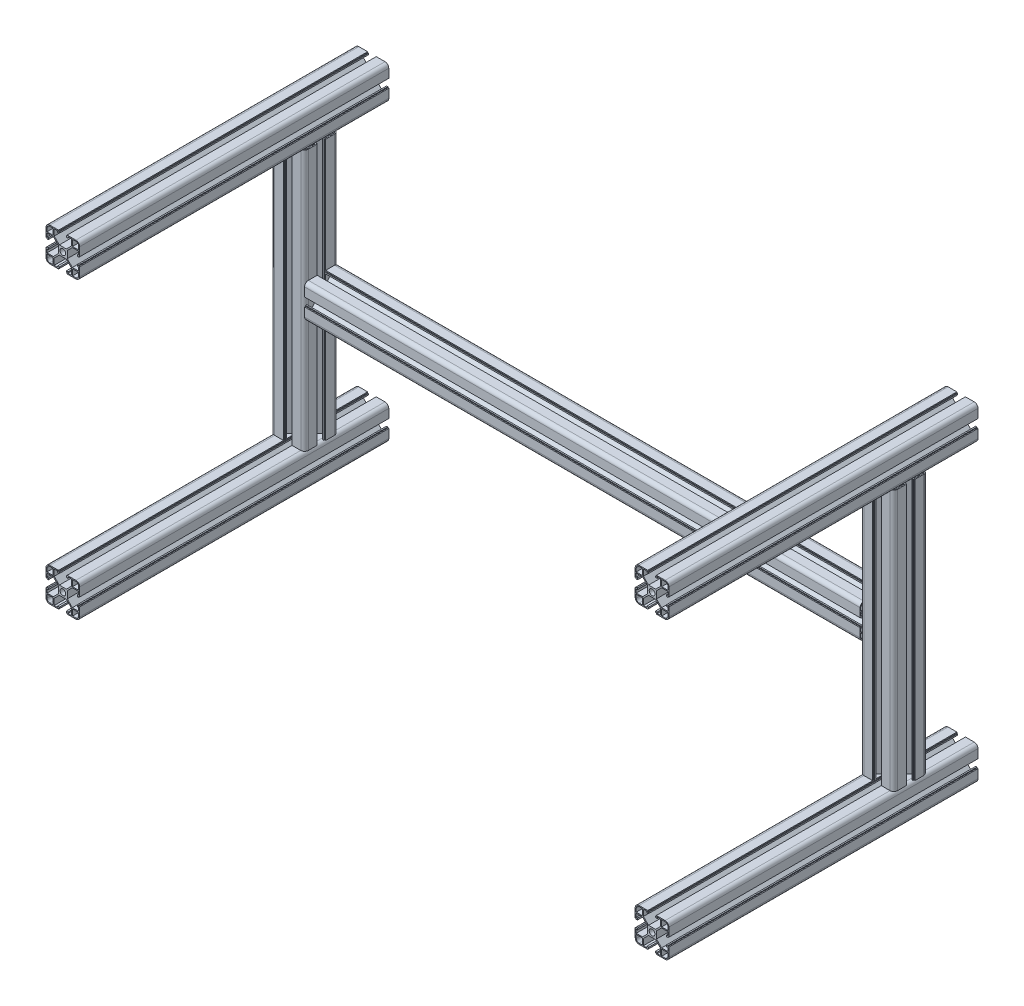
from build123d import *

# Parameters (mm, degrees)
SKETCH_1_R                         = 3.4
MEMBER_4040_1_5_4040_1_5_1_DEPTH   = 367.21
SKETCH_1_ON_SEGMENT_2_R            = 3.4
MEMBER_4040_1_5_4040_1_5_1_2_DEPTH = 367.21
SKETCH_1_ON_SEGMENT_3_R            = 3.4
MEMBER_4040_1_5_4040_1_5_1_3_DEPTH = 367.21
SKETCH_1_ON_SEGMENT_4_R            = 3.4
MEMBER_4040_1_5_4040_1_5_1_4_DEPTH = 367.21
SKETCH_1_ON_SEGMENT_5_R            = 3.4
MEMBER_4040_1_5_4040_1_5_1_5_DEPTH = 352
SKETCH_1_ON_SEGMENT_6_R            = 3.4
MEMBER_4040_1_5_4040_1_5_1_6_DEPTH = 352
SKETCH_1_ON_SEGMENT_7_R            = 3.4
MEMBER_4040_1_5_4040_1_5_1_7_DEPTH = 702


with BuildPart() as part:
    # 草图1 → Member 4040-_1.5 _4040_1.5_1 (new body)
    with BuildSketch(Plane(origin=(-350, -175, 0), x_dir=(1, 0, 0), z_dir=(0, 0, 1))):
        with BuildLine():
            Line((-5.25, -4.189339828), (-5.25, 4.189339828))
            Line((-5.25, 4.189339828), (-11.310660172, 10.25))
            Line((-11.310660172, 10.25), (-18.8, 10.25))
            Line((-18.8, 10.25), (-18.8, 6.1))
            Line((-18.8, 6.1), (-17.3, 6.1))
            Line((-17.3, 6.1), (-17.3, 4.1))
            Line((-17.3, 4.1), (-18.8, 4.1))
            Line((-18.8, 4.1), (-18.8, 5.1))
            Line((-18.8, 5.1), (-20, 5.1))
            Line((-20, 5.1), (-20, 15.5))
            ThreePointArc((-20, 15.5), (-18.681980515, 18.681980515), (-15.5, 20))
            Line((-15.5, 20), (-5.1, 20))
            Line((-5.1, 20), (-5.1, 18.8))
            Line((-5.1, 18.8), (-4.1, 18.8))
            Line((-4.1, 18.8), (-4.1, 17.3))
            Line((-4.1, 17.3), (-6.1, 17.3))
            Line((-6.1, 17.3), (-6.1, 18.8))
            Line((-6.1, 18.8), (-10.25, 18.8))
            Line((-10.25, 18.8), (-10.25, 11.310660172))
            Line((-10.25, 11.310660172), (-4.189339828, 5.25))
            Line((-4.189339828, 5.25), (4.189339828, 5.25))
            Line((4.189339828, 5.25), (10.25, 11.310660172))
            Line((10.25, 11.310660172), (10.25, 18.8))
            Line((10.25, 18.8), (6.1, 18.8))
            Line((6.1, 18.8), (6.1, 17.3))
            Line((6.1, 17.3), (4.1, 17.3))
            Line((4.1, 17.3), (4.1, 18.8))
            Line((4.1, 18.8), (5.1, 18.8))
            Line((5.1, 18.8), (5.1, 20))
            Line((5.1, 20), (15.5, 20))
            ThreePointArc((15.5, 20), (18.681980515, 18.681980515), (20, 15.5))
            Line((20, 15.5), (20, 5.1))
            Line((20, 5.1), (18.8, 5.1))
            Line((18.8, 5.1), (18.8, 4.1))
            Line((18.8, 4.1), (17.3, 4.1))
            Line((17.3, 4.1), (17.3, 6.1))
            Line((17.3, 6.1), (18.8, 6.1))
            Line((18.8, 6.1), (18.8, 10.25))
            Line((18.8, 10.25), (11.310660172, 10.25))
            Line((11.310660172, 10.25), (5.25, 4.189339828))
            Line((5.25, 4.189339828), (5.25, -4.189339828))
            Line((5.25, -4.189339828), (11.310660172, -10.25))
            Line((11.310660172, -10.25), (18.8, -10.25))
            Line((18.8, -10.25), (18.8, -6.1))
            Line((18.8, -6.1), (17.3, -6.1))
            Line((17.3, -6.1), (17.3, -4.1))
            Line((17.3, -4.1), (18.8, -4.1))
            Line((18.8, -4.1), (18.8, -5.1))
            Line((18.8, -5.1), (20, -5.1))
            Line((20, -5.1), (20, -15.5))
            ThreePointArc((20, -15.5), (18.681980515, -18.681980515), (15.5, -20))
            Line((15.5, -20), (5.1, -20))
            Line((5.1, -20), (5.1, -18.8))
            Line((5.1, -18.8), (4.1, -18.8))
            Line((4.1, -18.8), (4.1, -17.3))
            Line((4.1, -17.3), (6.1, -17.3))
            Line((6.1, -17.3), (6.1, -18.8))
            Line((6.1, -18.8), (10.25, -18.8))
            Line((10.25, -18.8), (10.25, -11.310660172))
            Line((10.25, -11.310660172), (4.189339828, -5.25))
            Line((4.189339828, -5.25), (-4.189339828, -5.25))
            Line((-4.189339828, -5.25), (-10.25, -11.310660172))
            Line((-10.25, -11.310660172), (-10.25, -18.8))
            Line((-10.25, -18.8), (-6.1, -18.8))
            Line((-6.1, -18.8), (-6.1, -17.3))
            Line((-6.1, -17.3), (-4.1, -17.3))
            Line((-4.1, -17.3), (-4.1, -18.8))
            Line((-4.1, -18.8), (-5.1, -18.8))
            Line((-5.1, -18.8), (-5.1, -20))
            Line((-5.1, -20), (-15.5, -20))
            ThreePointArc((-15.5, -20), (-18.681980515, -18.681980515), (-20, -15.5))
            Line((-20, -15.5), (-20, -5.1))
            Line((-20, -5.1), (-18.8, -5.1))
            Line((-18.8, -5.1), (-18.8, -4.1))
            Line((-18.8, -4.1), (-17.3, -4.1))
            Line((-17.3, -4.1), (-17.3, -6.1))
            Line((-17.3, -6.1), (-18.8, -6.1))
            Line((-18.8, -6.1), (-18.8, -10.25))
            Line((-18.8, -10.25), (-11.310660172, -10.25))
            Line((-11.310660172, -10.25), (-5.25, -4.189339828))
        make_face()
        Circle(SKETCH_1_R, mode=Mode.SUBTRACT)
        with BuildLine():
            Line((-11.45, 11.45), (-18.8, 11.45))
            Line((-18.8, 11.45), (-18.8, 15.5))
            ThreePointArc((-18.8, 15.5), (-17.833452378, 17.833452378), (-15.5, 18.8))
            Line((-15.5, 18.8), (-11.45, 18.8))
            Line((-11.45, 18.8), (-11.45, 11.45))
        make_face(mode=Mode.SUBTRACT)
        with BuildLine():
            Line((11.45, 11.45), (18.8, 11.45))
            Line((18.8, 11.45), (18.8, 15.5))
            ThreePointArc((18.8, 15.5), (17.833452378, 17.833452378), (15.5, 18.8))
            Line((15.5, 18.8), (11.45, 18.8))
            Line((11.45, 18.8), (11.45, 11.45))
        make_face(mode=Mode.SUBTRACT)
        with BuildLine():
            Line((11.45, -18.8), (15.5, -18.8))
            ThreePointArc((15.5, -18.8), (17.833452378, -17.833452378), (18.8, -15.5))
            Line((18.8, -15.5), (18.8, -11.45))
            Line((18.8, -11.45), (11.45, -11.45))
            Line((11.45, -11.45), (11.45, -18.8))
        make_face(mode=Mode.SUBTRACT)
        with BuildLine():
            Line((-11.45, -11.45), (-11.45, -18.8))
            Line((-11.45, -18.8), (-15.5, -18.8))
            ThreePointArc((-15.5, -18.8), (-17.833452378, -17.833452378), (-18.8, -15.5))
            Line((-18.8, -15.5), (-18.8, -11.45))
            Line((-18.8, -11.45), (-11.45, -11.45))
        make_face(mode=Mode.SUBTRACT)
    extrude(amount=MEMBER_4040_1_5_4040_1_5_1_DEPTH)


with BuildPart() as body_2:
    # 草图1 on segment 2 (carried to segment 2) → Member 4040-_1.5 _4040_1.5_1 2 (new body)
    with BuildSketch(Plane(origin=(-350, 175, 0), x_dir=(1, 0, 0), z_dir=(0, 0, 1))):
        with BuildLine():
            Line((-5.25, -4.189339828), (-5.25, 4.189339828))
            Line((-5.25, 4.189339828), (-11.310660172, 10.25))
            Line((-11.310660172, 10.25), (-18.8, 10.25))
            Line((-18.8, 10.25), (-18.8, 6.1))
            Line((-18.8, 6.1), (-17.3, 6.1))
            Line((-17.3, 6.1), (-17.3, 4.1))
            Line((-17.3, 4.1), (-18.8, 4.1))
            Line((-18.8, 4.1), (-18.8, 5.1))
            Line((-18.8, 5.1), (-20, 5.1))
            Line((-20, 5.1), (-20, 15.5))
            ThreePointArc((-20, 15.5), (-18.681980515, 18.681980515), (-15.5, 20))
            Line((-15.5, 20), (-5.1, 20))
            Line((-5.1, 20), (-5.1, 18.8))
            Line((-5.1, 18.8), (-4.1, 18.8))
            Line((-4.1, 18.8), (-4.1, 17.3))
            Line((-4.1, 17.3), (-6.1, 17.3))
            Line((-6.1, 17.3), (-6.1, 18.8))
            Line((-6.1, 18.8), (-10.25, 18.8))
            Line((-10.25, 18.8), (-10.25, 11.310660172))
            Line((-10.25, 11.310660172), (-4.189339828, 5.25))
            Line((-4.189339828, 5.25), (4.189339828, 5.25))
            Line((4.189339828, 5.25), (10.25, 11.310660172))
            Line((10.25, 11.310660172), (10.25, 18.8))
            Line((10.25, 18.8), (6.1, 18.8))
            Line((6.1, 18.8), (6.1, 17.3))
            Line((6.1, 17.3), (4.1, 17.3))
            Line((4.1, 17.3), (4.1, 18.8))
            Line((4.1, 18.8), (5.1, 18.8))
            Line((5.1, 18.8), (5.1, 20))
            Line((5.1, 20), (15.5, 20))
            ThreePointArc((15.5, 20), (18.681980515, 18.681980515), (20, 15.5))
            Line((20, 15.5), (20, 5.1))
            Line((20, 5.1), (18.8, 5.1))
            Line((18.8, 5.1), (18.8, 4.1))
            Line((18.8, 4.1), (17.3, 4.1))
            Line((17.3, 4.1), (17.3, 6.1))
            Line((17.3, 6.1), (18.8, 6.1))
            Line((18.8, 6.1), (18.8, 10.25))
            Line((18.8, 10.25), (11.310660172, 10.25))
            Line((11.310660172, 10.25), (5.25, 4.189339828))
            Line((5.25, 4.189339828), (5.25, -4.189339828))
            Line((5.25, -4.189339828), (11.310660172, -10.25))
            Line((11.310660172, -10.25), (18.8, -10.25))
            Line((18.8, -10.25), (18.8, -6.1))
            Line((18.8, -6.1), (17.3, -6.1))
            Line((17.3, -6.1), (17.3, -4.1))
            Line((17.3, -4.1), (18.8, -4.1))
            Line((18.8, -4.1), (18.8, -5.1))
            Line((18.8, -5.1), (20, -5.1))
            Line((20, -5.1), (20, -15.5))
            ThreePointArc((20, -15.5), (18.681980515, -18.681980515), (15.5, -20))
            Line((15.5, -20), (5.1, -20))
            Line((5.1, -20), (5.1, -18.8))
            Line((5.1, -18.8), (4.1, -18.8))
            Line((4.1, -18.8), (4.1, -17.3))
            Line((4.1, -17.3), (6.1, -17.3))
            Line((6.1, -17.3), (6.1, -18.8))
            Line((6.1, -18.8), (10.25, -18.8))
            Line((10.25, -18.8), (10.25, -11.310660172))
            Line((10.25, -11.310660172), (4.189339828, -5.25))
            Line((4.189339828, -5.25), (-4.189339828, -5.25))
            Line((-4.189339828, -5.25), (-10.25, -11.310660172))
            Line((-10.25, -11.310660172), (-10.25, -18.8))
            Line((-10.25, -18.8), (-6.1, -18.8))
            Line((-6.1, -18.8), (-6.1, -17.3))
            Line((-6.1, -17.3), (-4.1, -17.3))
            Line((-4.1, -17.3), (-4.1, -18.8))
            Line((-4.1, -18.8), (-5.1, -18.8))
            Line((-5.1, -18.8), (-5.1, -20))
            Line((-5.1, -20), (-15.5, -20))
            ThreePointArc((-15.5, -20), (-18.681980515, -18.681980515), (-20, -15.5))
            Line((-20, -15.5), (-20, -5.1))
            Line((-20, -5.1), (-18.8, -5.1))
            Line((-18.8, -5.1), (-18.8, -4.1))
            Line((-18.8, -4.1), (-17.3, -4.1))
            Line((-17.3, -4.1), (-17.3, -6.1))
            Line((-17.3, -6.1), (-18.8, -6.1))
            Line((-18.8, -6.1), (-18.8, -10.25))
            Line((-18.8, -10.25), (-11.310660172, -10.25))
            Line((-11.310660172, -10.25), (-5.25, -4.189339828))
        make_face()
        Circle(SKETCH_1_ON_SEGMENT_2_R, mode=Mode.SUBTRACT)
        with BuildLine():
            Line((-11.45, 11.45), (-18.8, 11.45))
            Line((-18.8, 11.45), (-18.8, 15.5))
            ThreePointArc((-18.8, 15.5), (-17.833452378, 17.833452378), (-15.5, 18.8))
            Line((-15.5, 18.8), (-11.45, 18.8))
            Line((-11.45, 18.8), (-11.45, 11.45))
        make_face(mode=Mode.SUBTRACT)
        with BuildLine():
            Line((11.45, 11.45), (18.8, 11.45))
            Line((18.8, 11.45), (18.8, 15.5))
            ThreePointArc((18.8, 15.5), (17.833452378, 17.833452378), (15.5, 18.8))
            Line((15.5, 18.8), (11.45, 18.8))
            Line((11.45, 18.8), (11.45, 11.45))
        make_face(mode=Mode.SUBTRACT)
        with BuildLine():
            Line((11.45, -18.8), (15.5, -18.8))
            ThreePointArc((15.5, -18.8), (17.833452378, -17.833452378), (18.8, -15.5))
            Line((18.8, -15.5), (18.8, -11.45))
            Line((18.8, -11.45), (11.45, -11.45))
            Line((11.45, -11.45), (11.45, -18.8))
        make_face(mode=Mode.SUBTRACT)
        with BuildLine():
            Line((-11.45, -11.45), (-11.45, -18.8))
            Line((-11.45, -18.8), (-15.5, -18.8))
            ThreePointArc((-15.5, -18.8), (-17.833452378, -17.833452378), (-18.8, -15.5))
            Line((-18.8, -15.5), (-18.8, -11.45))
            Line((-18.8, -11.45), (-11.45, -11.45))
        make_face(mode=Mode.SUBTRACT)
    extrude(amount=MEMBER_4040_1_5_4040_1_5_1_2_DEPTH)


with BuildPart() as body_3:
    # 草图1 on segment 3 (carried to segment 3) → Member 4040-_1.5 _4040_1.5_1 3 (new body)
    with BuildSketch(Plane(origin=(350, 175, 0), x_dir=(1, 0, 0), z_dir=(0, 0, 1))):
        with BuildLine():
            Line((-5.25, -4.189339828), (-5.25, 4.189339828))
            Line((-5.25, 4.189339828), (-11.310660172, 10.25))
            Line((-11.310660172, 10.25), (-18.8, 10.25))
            Line((-18.8, 10.25), (-18.8, 6.1))
            Line((-18.8, 6.1), (-17.3, 6.1))
            Line((-17.3, 6.1), (-17.3, 4.1))
            Line((-17.3, 4.1), (-18.8, 4.1))
            Line((-18.8, 4.1), (-18.8, 5.1))
            Line((-18.8, 5.1), (-20, 5.1))
            Line((-20, 5.1), (-20, 15.5))
            ThreePointArc((-20, 15.5), (-18.681980515, 18.681980515), (-15.5, 20))
            Line((-15.5, 20), (-5.1, 20))
            Line((-5.1, 20), (-5.1, 18.8))
            Line((-5.1, 18.8), (-4.1, 18.8))
            Line((-4.1, 18.8), (-4.1, 17.3))
            Line((-4.1, 17.3), (-6.1, 17.3))
            Line((-6.1, 17.3), (-6.1, 18.8))
            Line((-6.1, 18.8), (-10.25, 18.8))
            Line((-10.25, 18.8), (-10.25, 11.310660172))
            Line((-10.25, 11.310660172), (-4.189339828, 5.25))
            Line((-4.189339828, 5.25), (4.189339828, 5.25))
            Line((4.189339828, 5.25), (10.25, 11.310660172))
            Line((10.25, 11.310660172), (10.25, 18.8))
            Line((10.25, 18.8), (6.1, 18.8))
            Line((6.1, 18.8), (6.1, 17.3))
            Line((6.1, 17.3), (4.1, 17.3))
            Line((4.1, 17.3), (4.1, 18.8))
            Line((4.1, 18.8), (5.1, 18.8))
            Line((5.1, 18.8), (5.1, 20))
            Line((5.1, 20), (15.5, 20))
            ThreePointArc((15.5, 20), (18.681980515, 18.681980515), (20, 15.5))
            Line((20, 15.5), (20, 5.1))
            Line((20, 5.1), (18.8, 5.1))
            Line((18.8, 5.1), (18.8, 4.1))
            Line((18.8, 4.1), (17.3, 4.1))
            Line((17.3, 4.1), (17.3, 6.1))
            Line((17.3, 6.1), (18.8, 6.1))
            Line((18.8, 6.1), (18.8, 10.25))
            Line((18.8, 10.25), (11.310660172, 10.25))
            Line((11.310660172, 10.25), (5.25, 4.189339828))
            Line((5.25, 4.189339828), (5.25, -4.189339828))
            Line((5.25, -4.189339828), (11.310660172, -10.25))
            Line((11.310660172, -10.25), (18.8, -10.25))
            Line((18.8, -10.25), (18.8, -6.1))
            Line((18.8, -6.1), (17.3, -6.1))
            Line((17.3, -6.1), (17.3, -4.1))
            Line((17.3, -4.1), (18.8, -4.1))
            Line((18.8, -4.1), (18.8, -5.1))
            Line((18.8, -5.1), (20, -5.1))
            Line((20, -5.1), (20, -15.5))
            ThreePointArc((20, -15.5), (18.681980515, -18.681980515), (15.5, -20))
            Line((15.5, -20), (5.1, -20))
            Line((5.1, -20), (5.1, -18.8))
            Line((5.1, -18.8), (4.1, -18.8))
            Line((4.1, -18.8), (4.1, -17.3))
            Line((4.1, -17.3), (6.1, -17.3))
            Line((6.1, -17.3), (6.1, -18.8))
            Line((6.1, -18.8), (10.25, -18.8))
            Line((10.25, -18.8), (10.25, -11.310660172))
            Line((10.25, -11.310660172), (4.189339828, -5.25))
            Line((4.189339828, -5.25), (-4.189339828, -5.25))
            Line((-4.189339828, -5.25), (-10.25, -11.310660172))
            Line((-10.25, -11.310660172), (-10.25, -18.8))
            Line((-10.25, -18.8), (-6.1, -18.8))
            Line((-6.1, -18.8), (-6.1, -17.3))
            Line((-6.1, -17.3), (-4.1, -17.3))
            Line((-4.1, -17.3), (-4.1, -18.8))
            Line((-4.1, -18.8), (-5.1, -18.8))
            Line((-5.1, -18.8), (-5.1, -20))
            Line((-5.1, -20), (-15.5, -20))
            ThreePointArc((-15.5, -20), (-18.681980515, -18.681980515), (-20, -15.5))
            Line((-20, -15.5), (-20, -5.1))
            Line((-20, -5.1), (-18.8, -5.1))
            Line((-18.8, -5.1), (-18.8, -4.1))
            Line((-18.8, -4.1), (-17.3, -4.1))
            Line((-17.3, -4.1), (-17.3, -6.1))
            Line((-17.3, -6.1), (-18.8, -6.1))
            Line((-18.8, -6.1), (-18.8, -10.25))
            Line((-18.8, -10.25), (-11.310660172, -10.25))
            Line((-11.310660172, -10.25), (-5.25, -4.189339828))
        make_face()
        Circle(SKETCH_1_ON_SEGMENT_3_R, mode=Mode.SUBTRACT)
        with BuildLine():
            Line((-11.45, 11.45), (-18.8, 11.45))
            Line((-18.8, 11.45), (-18.8, 15.5))
            ThreePointArc((-18.8, 15.5), (-17.833452378, 17.833452378), (-15.5, 18.8))
            Line((-15.5, 18.8), (-11.45, 18.8))
            Line((-11.45, 18.8), (-11.45, 11.45))
        make_face(mode=Mode.SUBTRACT)
        with BuildLine():
            Line((11.45, 11.45), (18.8, 11.45))
            Line((18.8, 11.45), (18.8, 15.5))
            ThreePointArc((18.8, 15.5), (17.833452378, 17.833452378), (15.5, 18.8))
            Line((15.5, 18.8), (11.45, 18.8))
            Line((11.45, 18.8), (11.45, 11.45))
        make_face(mode=Mode.SUBTRACT)
        with BuildLine():
            Line((11.45, -18.8), (15.5, -18.8))
            ThreePointArc((15.5, -18.8), (17.833452378, -17.833452378), (18.8, -15.5))
            Line((18.8, -15.5), (18.8, -11.45))
            Line((18.8, -11.45), (11.45, -11.45))
            Line((11.45, -11.45), (11.45, -18.8))
        make_face(mode=Mode.SUBTRACT)
        with BuildLine():
            Line((-11.45, -11.45), (-11.45, -18.8))
            Line((-11.45, -18.8), (-15.5, -18.8))
            ThreePointArc((-15.5, -18.8), (-17.833452378, -17.833452378), (-18.8, -15.5))
            Line((-18.8, -15.5), (-18.8, -11.45))
            Line((-18.8, -11.45), (-11.45, -11.45))
        make_face(mode=Mode.SUBTRACT)
    extrude(amount=MEMBER_4040_1_5_4040_1_5_1_3_DEPTH)


with BuildPart() as body_4:
    # 草图1 on segment 4 (carried to segment 4) → Member 4040-_1.5 _4040_1.5_1 4 (new body)
    with BuildSketch(Plane(origin=(350, -175, 0), x_dir=(1, 0, 0), z_dir=(0, 0, 1))):
        with BuildLine():
            Line((-5.25, -4.189339828), (-5.25, 4.189339828))
            Line((-5.25, 4.189339828), (-11.310660172, 10.25))
            Line((-11.310660172, 10.25), (-18.8, 10.25))
            Line((-18.8, 10.25), (-18.8, 6.1))
            Line((-18.8, 6.1), (-17.3, 6.1))
            Line((-17.3, 6.1), (-17.3, 4.1))
            Line((-17.3, 4.1), (-18.8, 4.1))
            Line((-18.8, 4.1), (-18.8, 5.1))
            Line((-18.8, 5.1), (-20, 5.1))
            Line((-20, 5.1), (-20, 15.5))
            ThreePointArc((-20, 15.5), (-18.681980515, 18.681980515), (-15.5, 20))
            Line((-15.5, 20), (-5.1, 20))
            Line((-5.1, 20), (-5.1, 18.8))
            Line((-5.1, 18.8), (-4.1, 18.8))
            Line((-4.1, 18.8), (-4.1, 17.3))
            Line((-4.1, 17.3), (-6.1, 17.3))
            Line((-6.1, 17.3), (-6.1, 18.8))
            Line((-6.1, 18.8), (-10.25, 18.8))
            Line((-10.25, 18.8), (-10.25, 11.310660172))
            Line((-10.25, 11.310660172), (-4.189339828, 5.25))
            Line((-4.189339828, 5.25), (4.189339828, 5.25))
            Line((4.189339828, 5.25), (10.25, 11.310660172))
            Line((10.25, 11.310660172), (10.25, 18.8))
            Line((10.25, 18.8), (6.1, 18.8))
            Line((6.1, 18.8), (6.1, 17.3))
            Line((6.1, 17.3), (4.1, 17.3))
            Line((4.1, 17.3), (4.1, 18.8))
            Line((4.1, 18.8), (5.1, 18.8))
            Line((5.1, 18.8), (5.1, 20))
            Line((5.1, 20), (15.5, 20))
            ThreePointArc((15.5, 20), (18.681980515, 18.681980515), (20, 15.5))
            Line((20, 15.5), (20, 5.1))
            Line((20, 5.1), (18.8, 5.1))
            Line((18.8, 5.1), (18.8, 4.1))
            Line((18.8, 4.1), (17.3, 4.1))
            Line((17.3, 4.1), (17.3, 6.1))
            Line((17.3, 6.1), (18.8, 6.1))
            Line((18.8, 6.1), (18.8, 10.25))
            Line((18.8, 10.25), (11.310660172, 10.25))
            Line((11.310660172, 10.25), (5.25, 4.189339828))
            Line((5.25, 4.189339828), (5.25, -4.189339828))
            Line((5.25, -4.189339828), (11.310660172, -10.25))
            Line((11.310660172, -10.25), (18.8, -10.25))
            Line((18.8, -10.25), (18.8, -6.1))
            Line((18.8, -6.1), (17.3, -6.1))
            Line((17.3, -6.1), (17.3, -4.1))
            Line((17.3, -4.1), (18.8, -4.1))
            Line((18.8, -4.1), (18.8, -5.1))
            Line((18.8, -5.1), (20, -5.1))
            Line((20, -5.1), (20, -15.5))
            ThreePointArc((20, -15.5), (18.681980515, -18.681980515), (15.5, -20))
            Line((15.5, -20), (5.1, -20))
            Line((5.1, -20), (5.1, -18.8))
            Line((5.1, -18.8), (4.1, -18.8))
            Line((4.1, -18.8), (4.1, -17.3))
            Line((4.1, -17.3), (6.1, -17.3))
            Line((6.1, -17.3), (6.1, -18.8))
            Line((6.1, -18.8), (10.25, -18.8))
            Line((10.25, -18.8), (10.25, -11.310660172))
            Line((10.25, -11.310660172), (4.189339828, -5.25))
            Line((4.189339828, -5.25), (-4.189339828, -5.25))
            Line((-4.189339828, -5.25), (-10.25, -11.310660172))
            Line((-10.25, -11.310660172), (-10.25, -18.8))
            Line((-10.25, -18.8), (-6.1, -18.8))
            Line((-6.1, -18.8), (-6.1, -17.3))
            Line((-6.1, -17.3), (-4.1, -17.3))
            Line((-4.1, -17.3), (-4.1, -18.8))
            Line((-4.1, -18.8), (-5.1, -18.8))
            Line((-5.1, -18.8), (-5.1, -20))
            Line((-5.1, -20), (-15.5, -20))
            ThreePointArc((-15.5, -20), (-18.681980515, -18.681980515), (-20, -15.5))
            Line((-20, -15.5), (-20, -5.1))
            Line((-20, -5.1), (-18.8, -5.1))
            Line((-18.8, -5.1), (-18.8, -4.1))
            Line((-18.8, -4.1), (-17.3, -4.1))
            Line((-17.3, -4.1), (-17.3, -6.1))
            Line((-17.3, -6.1), (-18.8, -6.1))
            Line((-18.8, -6.1), (-18.8, -10.25))
            Line((-18.8, -10.25), (-11.310660172, -10.25))
            Line((-11.310660172, -10.25), (-5.25, -4.189339828))
        make_face()
        Circle(SKETCH_1_ON_SEGMENT_4_R, mode=Mode.SUBTRACT)
        with BuildLine():
            Line((-11.45, 11.45), (-18.8, 11.45))
            Line((-18.8, 11.45), (-18.8, 15.5))
            ThreePointArc((-18.8, 15.5), (-17.833452378, 17.833452378), (-15.5, 18.8))
            Line((-15.5, 18.8), (-11.45, 18.8))
            Line((-11.45, 18.8), (-11.45, 11.45))
        make_face(mode=Mode.SUBTRACT)
        with BuildLine():
            Line((11.45, 11.45), (18.8, 11.45))
            Line((18.8, 11.45), (18.8, 15.5))
            ThreePointArc((18.8, 15.5), (17.833452378, 17.833452378), (15.5, 18.8))
            Line((15.5, 18.8), (11.45, 18.8))
            Line((11.45, 18.8), (11.45, 11.45))
        make_face(mode=Mode.SUBTRACT)
        with BuildLine():
            Line((11.45, -18.8), (15.5, -18.8))
            ThreePointArc((15.5, -18.8), (17.833452378, -17.833452378), (18.8, -15.5))
            Line((18.8, -15.5), (18.8, -11.45))
            Line((18.8, -11.45), (11.45, -11.45))
            Line((11.45, -11.45), (11.45, -18.8))
        make_face(mode=Mode.SUBTRACT)
        with BuildLine():
            Line((-11.45, -11.45), (-11.45, -18.8))
            Line((-11.45, -18.8), (-15.5, -18.8))
            ThreePointArc((-15.5, -18.8), (-17.833452378, -17.833452378), (-18.8, -15.5))
            Line((-18.8, -15.5), (-18.8, -11.45))
            Line((-18.8, -11.45), (-11.45, -11.45))
        make_face(mode=Mode.SUBTRACT)
    extrude(amount=MEMBER_4040_1_5_4040_1_5_1_4_DEPTH)


with BuildPart() as body_5:
    # 草图1 on segment 5 (carried to segment 5) → Member 4040-_1.5 _4040_1.5_1 5 (new body)
    with BuildSketch(Plane(origin=(-350, -176, 80), x_dir=(1, 0, 0), z_dir=(0, 1, 0))):
        with BuildLine():
            Line((-5.25, -4.189339828), (-5.25, 4.189339828))
            Line((-5.25, 4.189339828), (-11.310660172, 10.25))
            Line((-11.310660172, 10.25), (-18.8, 10.25))
            Line((-18.8, 10.25), (-18.8, 6.1))
            Line((-18.8, 6.1), (-17.3, 6.1))
            Line((-17.3, 6.1), (-17.3, 4.1))
            Line((-17.3, 4.1), (-18.8, 4.1))
            Line((-18.8, 4.1), (-18.8, 5.1))
            Line((-18.8, 5.1), (-20, 5.1))
            Line((-20, 5.1), (-20, 15.5))
            ThreePointArc((-20, 15.5), (-18.681980515, 18.681980515), (-15.5, 20))
            Line((-15.5, 20), (-5.1, 20))
            Line((-5.1, 20), (-5.1, 18.8))
            Line((-5.1, 18.8), (-4.1, 18.8))
            Line((-4.1, 18.8), (-4.1, 17.3))
            Line((-4.1, 17.3), (-6.1, 17.3))
            Line((-6.1, 17.3), (-6.1, 18.8))
            Line((-6.1, 18.8), (-10.25, 18.8))
            Line((-10.25, 18.8), (-10.25, 11.310660172))
            Line((-10.25, 11.310660172), (-4.189339828, 5.25))
            Line((-4.189339828, 5.25), (4.189339828, 5.25))
            Line((4.189339828, 5.25), (10.25, 11.310660172))
            Line((10.25, 11.310660172), (10.25, 18.8))
            Line((10.25, 18.8), (6.1, 18.8))
            Line((6.1, 18.8), (6.1, 17.3))
            Line((6.1, 17.3), (4.1, 17.3))
            Line((4.1, 17.3), (4.1, 18.8))
            Line((4.1, 18.8), (5.1, 18.8))
            Line((5.1, 18.8), (5.1, 20))
            Line((5.1, 20), (15.5, 20))
            ThreePointArc((15.5, 20), (18.681980515, 18.681980515), (20, 15.5))
            Line((20, 15.5), (20, 5.1))
            Line((20, 5.1), (18.8, 5.1))
            Line((18.8, 5.1), (18.8, 4.1))
            Line((18.8, 4.1), (17.3, 4.1))
            Line((17.3, 4.1), (17.3, 6.1))
            Line((17.3, 6.1), (18.8, 6.1))
            Line((18.8, 6.1), (18.8, 10.25))
            Line((18.8, 10.25), (11.310660172, 10.25))
            Line((11.310660172, 10.25), (5.25, 4.189339828))
            Line((5.25, 4.189339828), (5.25, -4.189339828))
            Line((5.25, -4.189339828), (11.310660172, -10.25))
            Line((11.310660172, -10.25), (18.8, -10.25))
            Line((18.8, -10.25), (18.8, -6.1))
            Line((18.8, -6.1), (17.3, -6.1))
            Line((17.3, -6.1), (17.3, -4.1))
            Line((17.3, -4.1), (18.8, -4.1))
            Line((18.8, -4.1), (18.8, -5.1))
            Line((18.8, -5.1), (20, -5.1))
            Line((20, -5.1), (20, -15.5))
            ThreePointArc((20, -15.5), (18.681980515, -18.681980515), (15.5, -20))
            Line((15.5, -20), (5.1, -20))
            Line((5.1, -20), (5.1, -18.8))
            Line((5.1, -18.8), (4.1, -18.8))
            Line((4.1, -18.8), (4.1, -17.3))
            Line((4.1, -17.3), (6.1, -17.3))
            Line((6.1, -17.3), (6.1, -18.8))
            Line((6.1, -18.8), (10.25, -18.8))
            Line((10.25, -18.8), (10.25, -11.310660172))
            Line((10.25, -11.310660172), (4.189339828, -5.25))
            Line((4.189339828, -5.25), (-4.189339828, -5.25))
            Line((-4.189339828, -5.25), (-10.25, -11.310660172))
            Line((-10.25, -11.310660172), (-10.25, -18.8))
            Line((-10.25, -18.8), (-6.1, -18.8))
            Line((-6.1, -18.8), (-6.1, -17.3))
            Line((-6.1, -17.3), (-4.1, -17.3))
            Line((-4.1, -17.3), (-4.1, -18.8))
            Line((-4.1, -18.8), (-5.1, -18.8))
            Line((-5.1, -18.8), (-5.1, -20))
            Line((-5.1, -20), (-15.5, -20))
            ThreePointArc((-15.5, -20), (-18.681980515, -18.681980515), (-20, -15.5))
            Line((-20, -15.5), (-20, -5.1))
            Line((-20, -5.1), (-18.8, -5.1))
            Line((-18.8, -5.1), (-18.8, -4.1))
            Line((-18.8, -4.1), (-17.3, -4.1))
            Line((-17.3, -4.1), (-17.3, -6.1))
            Line((-17.3, -6.1), (-18.8, -6.1))
            Line((-18.8, -6.1), (-18.8, -10.25))
            Line((-18.8, -10.25), (-11.310660172, -10.25))
            Line((-11.310660172, -10.25), (-5.25, -4.189339828))
        make_face()
        Circle(SKETCH_1_ON_SEGMENT_5_R, mode=Mode.SUBTRACT)
        with BuildLine():
            Line((-11.45, 11.45), (-18.8, 11.45))
            Line((-18.8, 11.45), (-18.8, 15.5))
            ThreePointArc((-18.8, 15.5), (-17.833452378, 17.833452378), (-15.5, 18.8))
            Line((-15.5, 18.8), (-11.45, 18.8))
            Line((-11.45, 18.8), (-11.45, 11.45))
        make_face(mode=Mode.SUBTRACT)
        with BuildLine():
            Line((11.45, 11.45), (18.8, 11.45))
            Line((18.8, 11.45), (18.8, 15.5))
            ThreePointArc((18.8, 15.5), (17.833452378, 17.833452378), (15.5, 18.8))
            Line((15.5, 18.8), (11.45, 18.8))
            Line((11.45, 18.8), (11.45, 11.45))
        make_face(mode=Mode.SUBTRACT)
        with BuildLine():
            Line((11.45, -18.8), (15.5, -18.8))
            ThreePointArc((15.5, -18.8), (17.833452378, -17.833452378), (18.8, -15.5))
            Line((18.8, -15.5), (18.8, -11.45))
            Line((18.8, -11.45), (11.45, -11.45))
            Line((11.45, -11.45), (11.45, -18.8))
        make_face(mode=Mode.SUBTRACT)
        with BuildLine():
            Line((-11.45, -11.45), (-11.45, -18.8))
            Line((-11.45, -18.8), (-15.5, -18.8))
            ThreePointArc((-15.5, -18.8), (-17.833452378, -17.833452378), (-18.8, -15.5))
            Line((-18.8, -15.5), (-18.8, -11.45))
            Line((-18.8, -11.45), (-11.45, -11.45))
        make_face(mode=Mode.SUBTRACT)
    extrude(amount=MEMBER_4040_1_5_4040_1_5_1_5_DEPTH)

    # Member 4040-_1.5 _4040_1.5_1 5 end butt
    split(bisect_by=Plane(origin=(-350, -155, 80), x_dir=(-1, 0, 0), z_dir=(0, 1, 0)), keep=Keep.TOP)

    # Member 4040-_1.5 _4040_1.5_1 5 end b 2
    split(bisect_by=Plane(origin=(-350, 155, 80), x_dir=(1, 0, 0), z_dir=(0, -1, 0)), keep=Keep.TOP)


with BuildPart() as body_6:
    # 草图1 on segment 6 (carried to segment 6) → Member 4040-_1.5 _4040_1.5_1 6 (new body)
    with BuildSketch(Plane(origin=(350, -176, 80), x_dir=(1, 0, 0), z_dir=(0, 1, 0))):
        with BuildLine():
            Line((-5.25, -4.189339828), (-5.25, 4.189339828))
            Line((-5.25, 4.189339828), (-11.310660172, 10.25))
            Line((-11.310660172, 10.25), (-18.8, 10.25))
            Line((-18.8, 10.25), (-18.8, 6.1))
            Line((-18.8, 6.1), (-17.3, 6.1))
            Line((-17.3, 6.1), (-17.3, 4.1))
            Line((-17.3, 4.1), (-18.8, 4.1))
            Line((-18.8, 4.1), (-18.8, 5.1))
            Line((-18.8, 5.1), (-20, 5.1))
            Line((-20, 5.1), (-20, 15.5))
            ThreePointArc((-20, 15.5), (-18.681980515, 18.681980515), (-15.5, 20))
            Line((-15.5, 20), (-5.1, 20))
            Line((-5.1, 20), (-5.1, 18.8))
            Line((-5.1, 18.8), (-4.1, 18.8))
            Line((-4.1, 18.8), (-4.1, 17.3))
            Line((-4.1, 17.3), (-6.1, 17.3))
            Line((-6.1, 17.3), (-6.1, 18.8))
            Line((-6.1, 18.8), (-10.25, 18.8))
            Line((-10.25, 18.8), (-10.25, 11.310660172))
            Line((-10.25, 11.310660172), (-4.189339828, 5.25))
            Line((-4.189339828, 5.25), (4.189339828, 5.25))
            Line((4.189339828, 5.25), (10.25, 11.310660172))
            Line((10.25, 11.310660172), (10.25, 18.8))
            Line((10.25, 18.8), (6.1, 18.8))
            Line((6.1, 18.8), (6.1, 17.3))
            Line((6.1, 17.3), (4.1, 17.3))
            Line((4.1, 17.3), (4.1, 18.8))
            Line((4.1, 18.8), (5.1, 18.8))
            Line((5.1, 18.8), (5.1, 20))
            Line((5.1, 20), (15.5, 20))
            ThreePointArc((15.5, 20), (18.681980515, 18.681980515), (20, 15.5))
            Line((20, 15.5), (20, 5.1))
            Line((20, 5.1), (18.8, 5.1))
            Line((18.8, 5.1), (18.8, 4.1))
            Line((18.8, 4.1), (17.3, 4.1))
            Line((17.3, 4.1), (17.3, 6.1))
            Line((17.3, 6.1), (18.8, 6.1))
            Line((18.8, 6.1), (18.8, 10.25))
            Line((18.8, 10.25), (11.310660172, 10.25))
            Line((11.310660172, 10.25), (5.25, 4.189339828))
            Line((5.25, 4.189339828), (5.25, -4.189339828))
            Line((5.25, -4.189339828), (11.310660172, -10.25))
            Line((11.310660172, -10.25), (18.8, -10.25))
            Line((18.8, -10.25), (18.8, -6.1))
            Line((18.8, -6.1), (17.3, -6.1))
            Line((17.3, -6.1), (17.3, -4.1))
            Line((17.3, -4.1), (18.8, -4.1))
            Line((18.8, -4.1), (18.8, -5.1))
            Line((18.8, -5.1), (20, -5.1))
            Line((20, -5.1), (20, -15.5))
            ThreePointArc((20, -15.5), (18.681980515, -18.681980515), (15.5, -20))
            Line((15.5, -20), (5.1, -20))
            Line((5.1, -20), (5.1, -18.8))
            Line((5.1, -18.8), (4.1, -18.8))
            Line((4.1, -18.8), (4.1, -17.3))
            Line((4.1, -17.3), (6.1, -17.3))
            Line((6.1, -17.3), (6.1, -18.8))
            Line((6.1, -18.8), (10.25, -18.8))
            Line((10.25, -18.8), (10.25, -11.310660172))
            Line((10.25, -11.310660172), (4.189339828, -5.25))
            Line((4.189339828, -5.25), (-4.189339828, -5.25))
            Line((-4.189339828, -5.25), (-10.25, -11.310660172))
            Line((-10.25, -11.310660172), (-10.25, -18.8))
            Line((-10.25, -18.8), (-6.1, -18.8))
            Line((-6.1, -18.8), (-6.1, -17.3))
            Line((-6.1, -17.3), (-4.1, -17.3))
            Line((-4.1, -17.3), (-4.1, -18.8))
            Line((-4.1, -18.8), (-5.1, -18.8))
            Line((-5.1, -18.8), (-5.1, -20))
            Line((-5.1, -20), (-15.5, -20))
            ThreePointArc((-15.5, -20), (-18.681980515, -18.681980515), (-20, -15.5))
            Line((-20, -15.5), (-20, -5.1))
            Line((-20, -5.1), (-18.8, -5.1))
            Line((-18.8, -5.1), (-18.8, -4.1))
            Line((-18.8, -4.1), (-17.3, -4.1))
            Line((-17.3, -4.1), (-17.3, -6.1))
            Line((-17.3, -6.1), (-18.8, -6.1))
            Line((-18.8, -6.1), (-18.8, -10.25))
            Line((-18.8, -10.25), (-11.310660172, -10.25))
            Line((-11.310660172, -10.25), (-5.25, -4.189339828))
        make_face()
        Circle(SKETCH_1_ON_SEGMENT_6_R, mode=Mode.SUBTRACT)
        with BuildLine():
            Line((-11.45, 11.45), (-18.8, 11.45))
            Line((-18.8, 11.45), (-18.8, 15.5))
            ThreePointArc((-18.8, 15.5), (-17.833452378, 17.833452378), (-15.5, 18.8))
            Line((-15.5, 18.8), (-11.45, 18.8))
            Line((-11.45, 18.8), (-11.45, 11.45))
        make_face(mode=Mode.SUBTRACT)
        with BuildLine():
            Line((11.45, 11.45), (18.8, 11.45))
            Line((18.8, 11.45), (18.8, 15.5))
            ThreePointArc((18.8, 15.5), (17.833452378, 17.833452378), (15.5, 18.8))
            Line((15.5, 18.8), (11.45, 18.8))
            Line((11.45, 18.8), (11.45, 11.45))
        make_face(mode=Mode.SUBTRACT)
        with BuildLine():
            Line((11.45, -18.8), (15.5, -18.8))
            ThreePointArc((15.5, -18.8), (17.833452378, -17.833452378), (18.8, -15.5))
            Line((18.8, -15.5), (18.8, -11.45))
            Line((18.8, -11.45), (11.45, -11.45))
            Line((11.45, -11.45), (11.45, -18.8))
        make_face(mode=Mode.SUBTRACT)
        with BuildLine():
            Line((-11.45, -11.45), (-11.45, -18.8))
            Line((-11.45, -18.8), (-15.5, -18.8))
            ThreePointArc((-15.5, -18.8), (-17.833452378, -17.833452378), (-18.8, -15.5))
            Line((-18.8, -15.5), (-18.8, -11.45))
            Line((-18.8, -11.45), (-11.45, -11.45))
        make_face(mode=Mode.SUBTRACT)
    extrude(amount=MEMBER_4040_1_5_4040_1_5_1_6_DEPTH)

    # Member 4040-_1.5 _4040_1.5_1 6 end butt
    split(bisect_by=Plane(origin=(350, -155, 80), x_dir=(-1, 0, 0), z_dir=(0, 1, 0)), keep=Keep.TOP)

    # Member 4040-_1.5 _4040_1.5_1 6 end b 2
    split(bisect_by=Plane(origin=(350, 155, 80), x_dir=(1, 0, 0), z_dir=(0, -1, 0)), keep=Keep.TOP)


with BuildPart() as body_7:
    # 草图1 on segment 7 (carried to segment 7) → Member 4040-_1.5 _4040_1.5_1 7 (new body)
    with BuildSketch(Plane(origin=(-351, 0, 80), x_dir=(0, 0, -1), z_dir=(1, 0, 0))):
        with BuildLine():
            Line((-5.25, -4.189339828), (-5.25, 4.189339828))
            Line((-5.25, 4.189339828), (-11.310660172, 10.25))
            Line((-11.310660172, 10.25), (-18.8, 10.25))
            Line((-18.8, 10.25), (-18.8, 6.1))
            Line((-18.8, 6.1), (-17.3, 6.1))
            Line((-17.3, 6.1), (-17.3, 4.1))
            Line((-17.3, 4.1), (-18.8, 4.1))
            Line((-18.8, 4.1), (-18.8, 5.1))
            Line((-18.8, 5.1), (-20, 5.1))
            Line((-20, 5.1), (-20, 15.5))
            ThreePointArc((-20, 15.5), (-18.681980515, 18.681980515), (-15.5, 20))
            Line((-15.5, 20), (-5.1, 20))
            Line((-5.1, 20), (-5.1, 18.8))
            Line((-5.1, 18.8), (-4.1, 18.8))
            Line((-4.1, 18.8), (-4.1, 17.3))
            Line((-4.1, 17.3), (-6.1, 17.3))
            Line((-6.1, 17.3), (-6.1, 18.8))
            Line((-6.1, 18.8), (-10.25, 18.8))
            Line((-10.25, 18.8), (-10.25, 11.310660172))
            Line((-10.25, 11.310660172), (-4.189339828, 5.25))
            Line((-4.189339828, 5.25), (4.189339828, 5.25))
            Line((4.189339828, 5.25), (10.25, 11.310660172))
            Line((10.25, 11.310660172), (10.25, 18.8))
            Line((10.25, 18.8), (6.1, 18.8))
            Line((6.1, 18.8), (6.1, 17.3))
            Line((6.1, 17.3), (4.1, 17.3))
            Line((4.1, 17.3), (4.1, 18.8))
            Line((4.1, 18.8), (5.1, 18.8))
            Line((5.1, 18.8), (5.1, 20))
            Line((5.1, 20), (15.5, 20))
            ThreePointArc((15.5, 20), (18.681980515, 18.681980515), (20, 15.5))
            Line((20, 15.5), (20, 5.1))
            Line((20, 5.1), (18.8, 5.1))
            Line((18.8, 5.1), (18.8, 4.1))
            Line((18.8, 4.1), (17.3, 4.1))
            Line((17.3, 4.1), (17.3, 6.1))
            Line((17.3, 6.1), (18.8, 6.1))
            Line((18.8, 6.1), (18.8, 10.25))
            Line((18.8, 10.25), (11.310660172, 10.25))
            Line((11.310660172, 10.25), (5.25, 4.189339828))
            Line((5.25, 4.189339828), (5.25, -4.189339828))
            Line((5.25, -4.189339828), (11.310660172, -10.25))
            Line((11.310660172, -10.25), (18.8, -10.25))
            Line((18.8, -10.25), (18.8, -6.1))
            Line((18.8, -6.1), (17.3, -6.1))
            Line((17.3, -6.1), (17.3, -4.1))
            Line((17.3, -4.1), (18.8, -4.1))
            Line((18.8, -4.1), (18.8, -5.1))
            Line((18.8, -5.1), (20, -5.1))
            Line((20, -5.1), (20, -15.5))
            ThreePointArc((20, -15.5), (18.681980515, -18.681980515), (15.5, -20))
            Line((15.5, -20), (5.1, -20))
            Line((5.1, -20), (5.1, -18.8))
            Line((5.1, -18.8), (4.1, -18.8))
            Line((4.1, -18.8), (4.1, -17.3))
            Line((4.1, -17.3), (6.1, -17.3))
            Line((6.1, -17.3), (6.1, -18.8))
            Line((6.1, -18.8), (10.25, -18.8))
            Line((10.25, -18.8), (10.25, -11.310660172))
            Line((10.25, -11.310660172), (4.189339828, -5.25))
            Line((4.189339828, -5.25), (-4.189339828, -5.25))
            Line((-4.189339828, -5.25), (-10.25, -11.310660172))
            Line((-10.25, -11.310660172), (-10.25, -18.8))
            Line((-10.25, -18.8), (-6.1, -18.8))
            Line((-6.1, -18.8), (-6.1, -17.3))
            Line((-6.1, -17.3), (-4.1, -17.3))
            Line((-4.1, -17.3), (-4.1, -18.8))
            Line((-4.1, -18.8), (-5.1, -18.8))
            Line((-5.1, -18.8), (-5.1, -20))
            Line((-5.1, -20), (-15.5, -20))
            ThreePointArc((-15.5, -20), (-18.681980515, -18.681980515), (-20, -15.5))
            Line((-20, -15.5), (-20, -5.1))
            Line((-20, -5.1), (-18.8, -5.1))
            Line((-18.8, -5.1), (-18.8, -4.1))
            Line((-18.8, -4.1), (-17.3, -4.1))
            Line((-17.3, -4.1), (-17.3, -6.1))
            Line((-17.3, -6.1), (-18.8, -6.1))
            Line((-18.8, -6.1), (-18.8, -10.25))
            Line((-18.8, -10.25), (-11.310660172, -10.25))
            Line((-11.310660172, -10.25), (-5.25, -4.189339828))
        make_face()
        Circle(SKETCH_1_ON_SEGMENT_7_R, mode=Mode.SUBTRACT)
        with BuildLine():
            Line((-11.45, 11.45), (-18.8, 11.45))
            Line((-18.8, 11.45), (-18.8, 15.5))
            ThreePointArc((-18.8, 15.5), (-17.833452378, 17.833452378), (-15.5, 18.8))
            Line((-15.5, 18.8), (-11.45, 18.8))
            Line((-11.45, 18.8), (-11.45, 11.45))
        make_face(mode=Mode.SUBTRACT)
        with BuildLine():
            Line((11.45, 11.45), (18.8, 11.45))
            Line((18.8, 11.45), (18.8, 15.5))
            ThreePointArc((18.8, 15.5), (17.833452378, 17.833452378), (15.5, 18.8))
            Line((15.5, 18.8), (11.45, 18.8))
            Line((11.45, 18.8), (11.45, 11.45))
        make_face(mode=Mode.SUBTRACT)
        with BuildLine():
            Line((11.45, -18.8), (15.5, -18.8))
            ThreePointArc((15.5, -18.8), (17.833452378, -17.833452378), (18.8, -15.5))
            Line((18.8, -15.5), (18.8, -11.45))
            Line((18.8, -11.45), (11.45, -11.45))
            Line((11.45, -11.45), (11.45, -18.8))
        make_face(mode=Mode.SUBTRACT)
        with BuildLine():
            Line((-11.45, -11.45), (-11.45, -18.8))
            Line((-11.45, -18.8), (-15.5, -18.8))
            ThreePointArc((-15.5, -18.8), (-17.833452378, -17.833452378), (-18.8, -15.5))
            Line((-18.8, -15.5), (-18.8, -11.45))
            Line((-18.8, -11.45), (-11.45, -11.45))
        make_face(mode=Mode.SUBTRACT)
    extrude(amount=MEMBER_4040_1_5_4040_1_5_1_7_DEPTH)

    # Member 4040-_1.5 _4040_1.5_1 7 end butt
    split(bisect_by=Plane(origin=(-330, 0, 80), x_dir=(0, 1, 0), z_dir=(1, 0, 0)), keep=Keep.TOP)

    # Member 4040-_1.5 _4040_1.5_1 7 end b 2
    split(bisect_by=Plane(origin=(330, 0, 80), x_dir=(0, -1, 0), z_dir=(-1, 0, 0)), keep=Keep.TOP)


solid = Compound([part.part, body_2.part, body_3.part, body_4.part, body_5.part, body_6.part, body_7.part])
